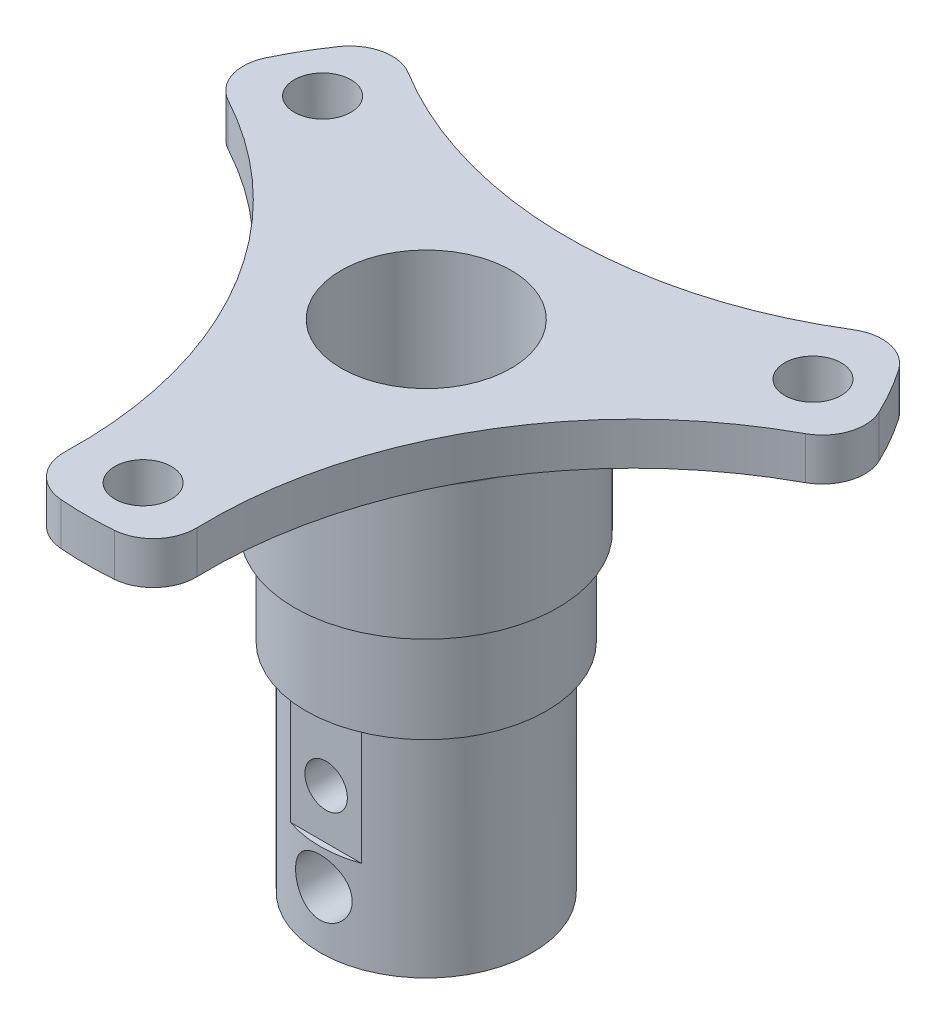
from build123d import *

# Parameters (mm, degrees)
CUT_EXTRUDE_1_DEPTH         = 20
SKETCH_4_R                  = 2
SKETCH_4_R_2                = 30
CUT_EXTRUDE_2_DEPTH         = 47.647615159
FILLET_1_R                  = 3
SKETCH_5_R                  = 2
SKETCH_5_R_2                = 1.5
CUT_EXTRUDE_3_DEPTH         = 20
CUT_EXTRUDE_5_DEPTH         = 8.5
SKETCH_9_R                  = 1.5
CUT_EXTRUDE_6_DEPTH         = 51.644290358
SKETCH_11_R                 = 8
CUT_EXTRUDE_8_DEPTH         = 5
HOLE_WIZARD_12_0_12_1_D     = 12
HOLE_WIZARD_12_0_12_1_DEPTH = 10
HOLE_WIZARD_12_0_12_1_TIP   = 3.605163714
FILLET_2_R                  = 0.6
CHAMFER_2_SIZE              = 0.5
CHAMFER_2_SIZE2             = 0.288675135
CHAMFER_3_SIZE              = 0.5
CHAMFER_3_SIZE2             = 0.288675135


with BuildPart() as part:
    # 草图2 → 旋转1 (revolve)
    with BuildSketch(Plane.XY, mode=Mode.PRIVATE) as revolve_1_sk:
        Polygon((-7.5, 0), (-7.5, 15), (-8.5, 15), (-8.5, 22), (-9.3, 22), (-9.3, 32), (-24, 32), (-24, 35), (-8, 35), (-8, 40), (-5, 40), (0, 40), (0, 0), (-5, 0), align=None)
    revolve(revolve_1_sk.sketch.rotate(Axis((0, 41.059829881, 0), (0, -1, 0)), 270), axis=Axis((0, 41.059829881, 0), (0, -1, 0)))

    # 草图3 → 切除-拉伸1 (cut)
    with BuildSketch(Plane.XZ):
        with BuildLine():
            Line((-3, 4), (3, 4))
            ThreePointArc((3, 4), (0, -5), (-3, 4))
        make_face()
    extrude(amount=-CUT_EXTRUDE_1_DEPTH, mode=Mode.SUBTRACT)

    # 草图4 → 切除-拉伸2 (cut, through all)
    with BuildSketch(Plane.XZ.offset(-32)):
        with Locations(Location((0, 20, 0), (0, 0, 270))):
            Circle(SKETCH_4_R)
        with Locations(Location((17.320508076, -10, 0), (0, 0, 270))):
            Circle(SKETCH_4_R)
        with Locations(Location((-17.320508076, -10, 0), (0, 0, 270))):
            Circle(SKETCH_4_R)
        with Locations((0, -40)):
            Circle(SKETCH_4_R_2)
        with Locations((-34.641016151, 20)):
            Circle(SKETCH_4_R_2)
        with Locations((34.641016151, 20)):
            Circle(SKETCH_4_R_2)
    extrude(amount=-CUT_EXTRUDE_2_DEPTH, mode=Mode.SUBTRACT)

    # 圆角1
    fillet_1_edges = [part.edges().sort_by_distance(p)[0] for p in [
        (-4.846535333, 33.5, 23.505554562),
        (-22.779675047, 33.5, -7.555554562),
        (-17.933139714, 33.5, -15.95),
        (17.933139714, 33.5, -15.95),
        (22.779675047, 33.5, -7.555554562),
        (4.846535333, 33.5, 23.505554562),
    ]]
    fillet(fillet_1_edges, radius=FILLET_1_R)

    # 草图5 → 切除-拉伸3 (cut)
    with BuildSketch(Plane.XY):
        with Locations(Location((0, 4, 0), (0, 0, 90))):
            Circle(SKETCH_5_R)
        with Locations(Location((0, 10, 0), (0, 0, 90))):
            Circle(SKETCH_5_R_2)
    extrude(amount=CUT_EXTRUDE_3_DEPTH, mode=Mode.SUBTRACT)

    # 草图8 → 切除-拉伸5 (cut)
    with BuildSketch(Plane.XZ.offset(-15)):
        with BuildLine():
            Line((-2.5, 7.071067812), (2.5, 7.071067812))
            ThreePointArc((2.5, 7.071067812), (0, 7.5), (-2.5, 7.071067812))
        make_face()
        with BuildLine():
            Line((-2.5, -7.071067812), (2.5, -7.071067812))
            ThreePointArc((2.5, -7.071067812), (0, -7.5), (-2.5, -7.071067812))
        make_face()
    extrude(amount=CUT_EXTRUDE_5_DEPTH, mode=Mode.SUBTRACT)

    # 草图9 → 切除-拉伸6 (cut, through all)
    with BuildSketch(Plane.XY.offset(7.071067812)):
        with Locations((0, 10)):
            Circle(SKETCH_9_R)
    extrude(amount=-CUT_EXTRUDE_6_DEPTH, mode=Mode.SUBTRACT)

    # 草图11 → 切除-拉伸8 (cut)
    with BuildSketch(Plane(origin=(0, 40, 0), x_dir=(1, 0, 0), z_dir=(0, 1, 0))):
        Circle(SKETCH_11_R)
    extrude(amount=-CUT_EXTRUDE_8_DEPTH, mode=Mode.SUBTRACT)

    # Ø12.0 (12) 直径孔1
    with Locations(Plane.ZX.offset(35)):
        with Locations((0, 0)):
            Hole(HOLE_WIZARD_12_0_12_1_D / 2, depth=HOLE_WIZARD_12_0_12_1_DEPTH)
            with Locations((0, 0, -(HOLE_WIZARD_12_0_12_1_DEPTH + HOLE_WIZARD_12_0_12_1_TIP / 2))):  # 118° drill point
                Cone(0, HOLE_WIZARD_12_0_12_1_D / 2, HOLE_WIZARD_12_0_12_1_TIP, mode=Mode.SUBTRACT)

    # 圆角2
    fillet_2_edges = [part.edges().sort_by_distance(p)[0] for p in [
        (0, 32, -9.3),
    ]]
    fillet(fillet_2_edges, radius=FILLET_2_R)

    # 倒角2
    chamfer_2_edges = [part.edges().sort_by_distance(p)[0] for p in [
        (0, 15, -8.5),
    ]]
    chamfer_2_side = [part.faces().sort_by_distance(p)[0] for p in [
        (-7.740416306, 15, 0),
    ]]
    chamfer(chamfer_2_edges, length=CHAMFER_2_SIZE, length2=CHAMFER_2_SIZE2, reference=chamfer_2_side[0])

    # 倒角3
    chamfer_3_edges = [part.edges().sort_by_distance(p)[0] for p in [
        (0, 0, -5),
    ]]
    chamfer_3_side = [part.faces().sort_by_distance(p)[0] for p in [
        (0, 0, -7.287867966),
    ]]
    chamfer(chamfer_3_edges, length=CHAMFER_3_SIZE, length2=CHAMFER_3_SIZE2, reference=chamfer_3_side[0])


solid = part.part
